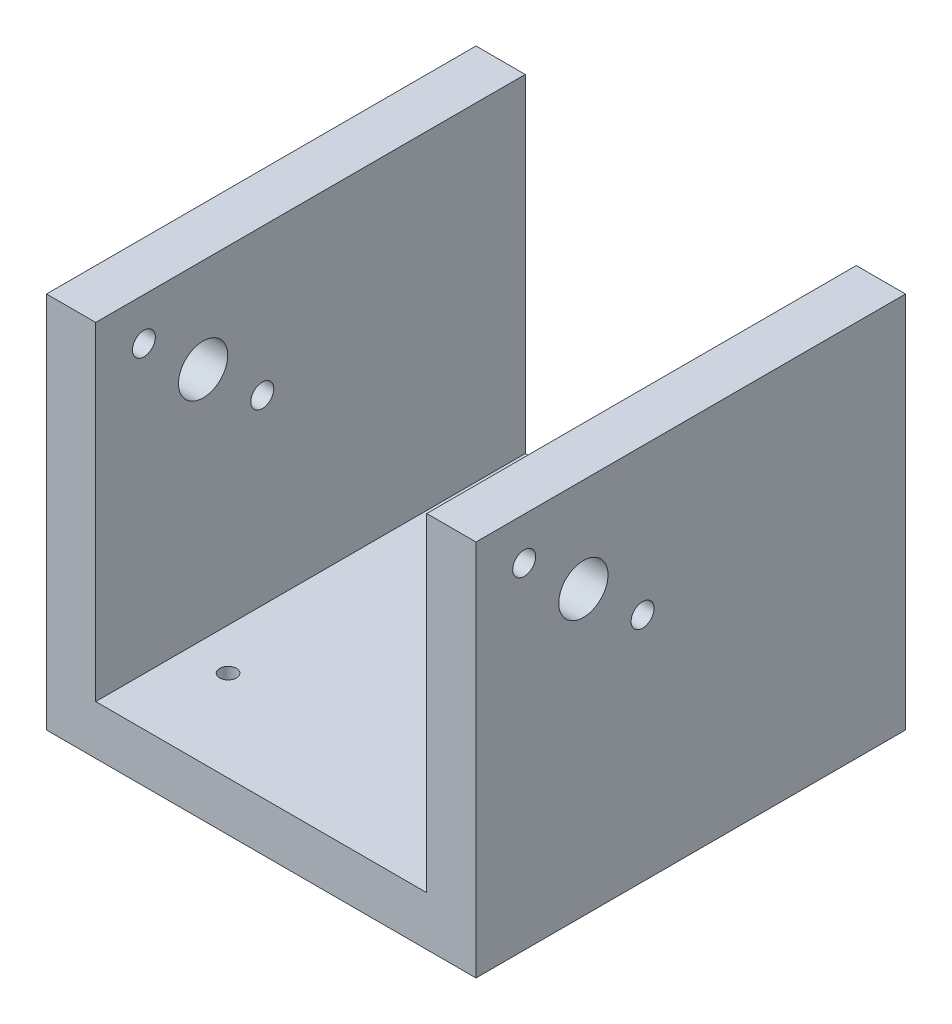
from build123d import *

# Parameters (mm, degrees)
SKETCH1_R           = 2.55
BOSS_EXTRUDE1_DEPTH = 15
BOSS_EXTRUDE2_DEPTH = 100
CUT_EXTRUDE1_REACH  = 188.053
SKETCH3_R           = 7.5
SKETCH3_R_2         = 3.5


with BuildPart() as part:
    # Sketch1 → Boss-Extrude1 (new body)
    with BuildSketch(Plane(origin=(0, 0, 0), x_dir=(1, 0, 0), z_dir=(0, 1, 0))):
        Polygon((-65.40737726, 35.40737726), (-65.40737726, 65.40737726), (-35.40737726, 65.40737726), (35.40737726, 65.40737726), (65.40737726, 65.40737726), (65.40737726, 35.40737726), (65.40737726, -35.40737726), (65.40737726, -65.40737726), (35.40737726, -65.40737726), (-35.40737726, -65.40737726), (-65.40737726, -65.40737726), (-65.40737726, -35.40737726), align=None)
        with Locations(Location((37.759502115, 37.759502115, 0), (0, 0, 270))):
            Circle(SKETCH1_R, mode=Mode.SUBTRACT)
        with Locations(Location((37.759502115, -37.759502115, 0), (0, 0, 270))):
            Circle(SKETCH1_R, mode=Mode.SUBTRACT)
        with Locations(Location((-37.759502115, -37.759502115, 0), (0, 0, 270))):
            Circle(SKETCH1_R, mode=Mode.SUBTRACT)
        with Locations(Location((-37.759502115, 37.759502115, 0), (0, 0, 270))):
            Circle(SKETCH1_R, mode=Mode.SUBTRACT)
    extrude(amount=BOSS_EXTRUDE1_DEPTH)

    # Sketch2 → Boss-Extrude2 (add)
    with BuildSketch(Plane(origin=(0, 15, 0), x_dir=(1, 0, 0), z_dir=(0, 1, 0))):
        Polygon((50.40737726, -50.40737726), (50.40737726, -65.40737726), (65.40737726, -65.40737726), (65.40737726, 65.40737726), (50.40737726, 65.40737726), (50.40737726, 50.40737726), align=None)
        Polygon((-65.40737726, 65.40737726), (-65.40737726, -65.40737726), (-50.40737726, -65.40737726), (-50.40737726, -50.40737726), (-50.40737726, 50.40737726), (-50.40737726, 65.40737726), align=None)
    extrude(amount=BOSS_EXTRUDE2_DEPTH)

    # Cut-Extrude1: up to this face of the body (flat: up to its plane)
    cut_extrude1_end = Plane(part.part.faces().sort_by_distance((65.40737726, 57.5, 0))[0])
    # Sketch3 → Cut-Extrude1 (cut, up to the picked face)
    with BuildSketch(Plane.ZY.offset(65.40737726), mode=Mode.PRIVATE) as cut_extrude1_sk1:
        with Locations((32.70368863, 86.25)):
            Circle(SKETCH3_R)
    cut_extrude1_tool1 = split(extrude(cut_extrude1_sk1.sketch, amount=-CUT_EXTRUDE1_REACH, mode=Mode.PRIVATE), bisect_by=cut_extrude1_end, keep=Keep.BOTH, mode=Mode.PRIVATE)
    # Sketch3 → Cut-Extrude1 (cut, up to the picked face)
    with BuildSketch(Plane.ZY.offset(65.40737726), mode=Mode.PRIVATE) as cut_extrude1_sk2:
        with Locations((14.678572243, 70.404016937)):
            Circle(SKETCH3_R_2)
    cut_extrude1_tool2 = split(extrude(cut_extrude1_sk2.sketch, amount=-CUT_EXTRUDE1_REACH, mode=Mode.PRIVATE), bisect_by=cut_extrude1_end, keep=Keep.BOTH, mode=Mode.PRIVATE)
    # Sketch3 → Cut-Extrude1 (cut, up to the picked face)
    with BuildSketch(Plane.ZY.offset(65.40737726), mode=Mode.PRIVATE) as cut_extrude1_sk3:
        with Locations((50.728805017, 102.095983063)):
            Circle(SKETCH3_R_2)
    cut_extrude1_tool3 = split(extrude(cut_extrude1_sk3.sketch, amount=-CUT_EXTRUDE1_REACH, mode=Mode.PRIVATE), bisect_by=cut_extrude1_end, keep=Keep.BOTH, mode=Mode.PRIVATE)
    add(cut_extrude1_tool1.solids().sort_by(Axis((-65.407377, 86.25, 32.703689), (1, 0, 0)))[0], mode=Mode.SUBTRACT)
    add(cut_extrude1_tool2.solids().sort_by(Axis((-65.407377, 70.404017, 14.678572), (1, 0, 0)))[0], mode=Mode.SUBTRACT)
    add(cut_extrude1_tool3.solids().sort_by(Axis((-65.407377, 102.095983, 50.728805), (1, 0, 0)))[0], mode=Mode.SUBTRACT)


solid = part.part
